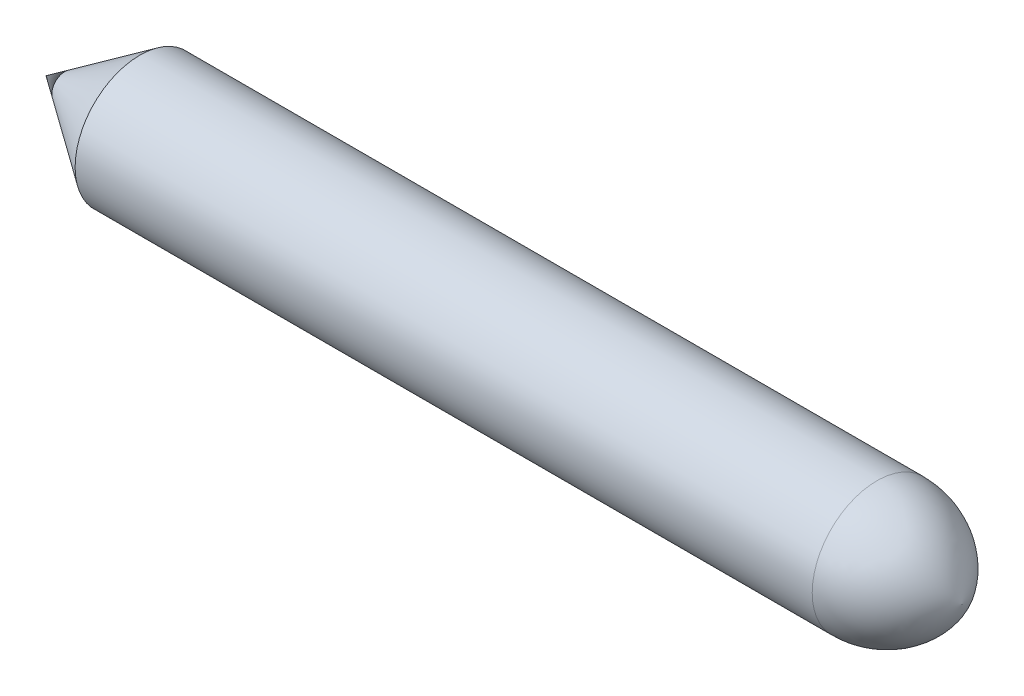
from build123d import *


with BuildPart() as part:
    # Croquis1 → Revolución2 (revolve)
    with BuildSketch(Plane(origin=(0, 0, 0), x_dir=(1, 0, 0), z_dir=(0, 1, 0))):
        with BuildLine():
            Line((0, 0), (74.745199113, 0))
            ThreePointArc((74.745199113, 0), (72.179599494, 3.812155114), (67.826736335, 5.284367847))
            Line((67.826736335, 5.284367847), (7.660818961, 5.284367847))
            Line((7.660818961, 5.284367847), (0, 0))
        make_face()
    revolve(axis=Axis((0, 0, 0), (1, 0, 0)))


solid = part.part
